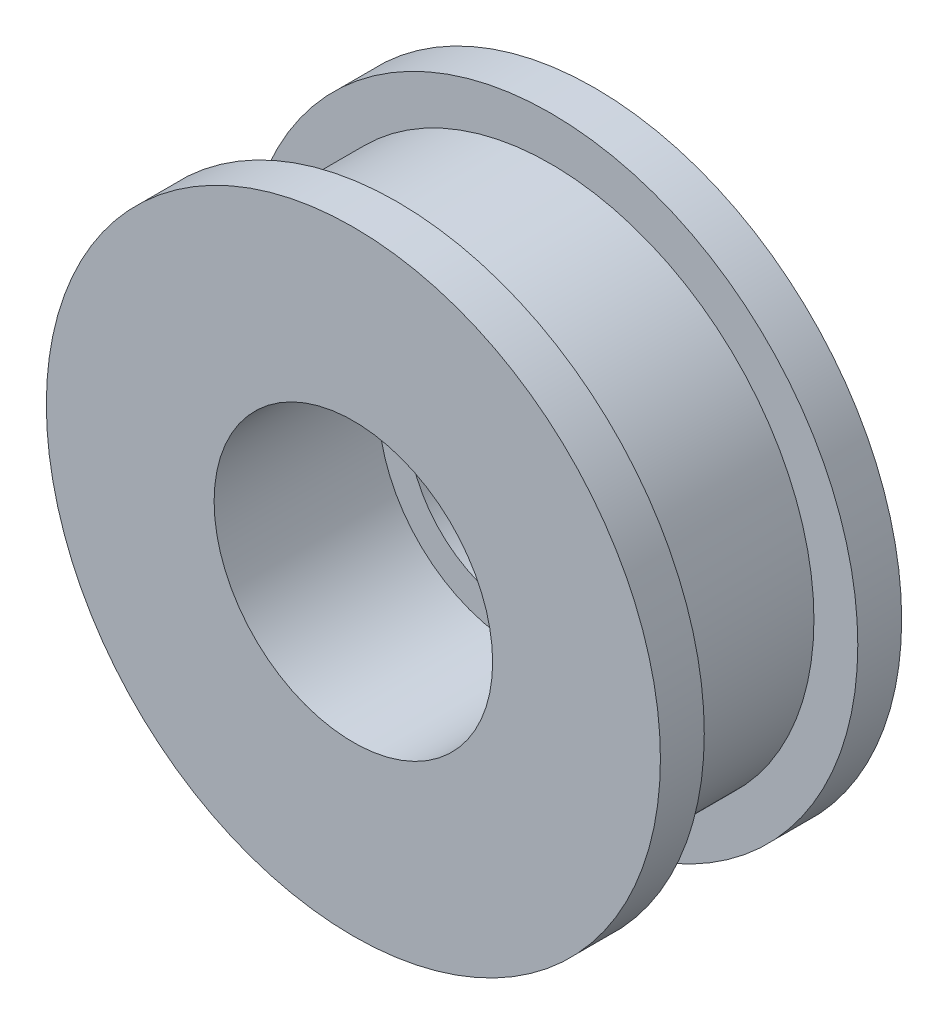
from build123d import *

# Parameters (mm, degrees)
SKETCH1_R            = 14
SKETCH1_R_2          = 2
TOP_FLANGE_DEPTH     = 2
SKETCH1_3_R          = 12
SKETCH1_3_R_2        = 2
CENTER_SPINDLE_DEPTH = 9
BOTTOM_START         = 9
SKETCH1_4_R          = 14
SKETCH1_4_R_2        = 2
BOTTOM_FLANGE_DEPTH  = 2
BEARING_START        = -7.5
SKETCH2_R            = 6.35
SKETCH2_R_2          = 2
BEARING_RECESS_DEPTH = 7.5
SKETCH2_3_R          = 5
SKETCH2_3_R_2        = 2
SCREW_OPENING_DEPTH  = 23.649503306


with BuildPart() as part:
    # Sketch1 → Top Flange (new body)
    with BuildSketch(Plane.XY):
        Circle(SKETCH1_R)
        Circle(SKETCH1_R_2, mode=Mode.SUBTRACT)
    extrude(amount=TOP_FLANGE_DEPTH)

    # Sketch1<3> → Center Spindle (add)
    with BuildSketch(Plane.XY):
        Circle(SKETCH1_3_R)
        Circle(SKETCH1_3_R_2, mode=Mode.SUBTRACT)
    extrude(amount=CENTER_SPINDLE_DEPTH)

    # Sketch1<4> → Bottom Flange (add)
    with BuildSketch(Plane.XY.offset(BOTTOM_START)):
        Circle(SKETCH1_4_R)
        Circle(SKETCH1_4_R_2, mode=Mode.SUBTRACT)
    extrude(amount=BOTTOM_FLANGE_DEPTH)

    # Sketch2 → Bearing Recess (cut)
    with BuildSketch(Plane.XY.offset(11).offset(BEARING_START)):
        Circle(SKETCH2_R)
        Circle(SKETCH2_R_2, mode=Mode.SUBTRACT)
    extrude(amount=BEARING_RECESS_DEPTH, mode=Mode.SUBTRACT)

    # Sketch2<3> → Screw Opening (cut, through all)
    with BuildSketch(Plane.XY.offset(11)):
        Circle(SKETCH2_3_R)
        Circle(SKETCH2_3_R_2, mode=Mode.SUBTRACT)
    extrude(amount=-SCREW_OPENING_DEPTH, mode=Mode.SUBTRACT)


solid = part.part
